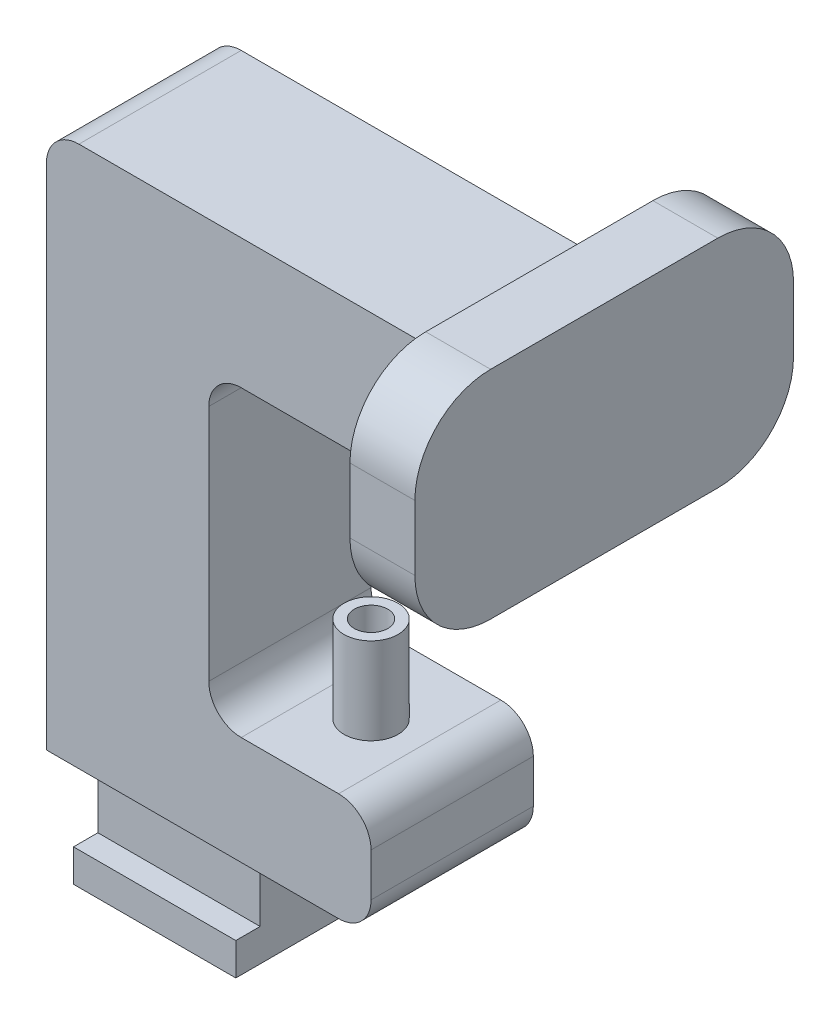
from build123d import *

# Parameters (mm, degrees)
BOSS_EXTRUDE1_DEPTH = 15
BOSS_EXTRUDE2_DEPTH = 10
SKETCH3_R           = 1.55
CUT_EXTRUDE1_DEPTH  = 50.497474683
BOSS_EXTRUDE3_START = 8
SKETCH4_R           = 2.5
SKETCH4_R_2         = 1.55
BOSS_EXTRUDE3_DEPTH = 8
SKETCH5_W           = 15
SKETCH5_H           = 12
BOSS_EXTRUDE4_DEPTH = 23.05
BOSS_EXTRUDE5_DEPTH = 5
SKETCH9_W           = 35
SKETCH9_H           = 20
BOSS_EXTRUDE6_DEPTH = 6
FILLET1_R           = 7
FILLET4_R           = 3
FILLET6_R           = 1


with BuildPart() as part:
    # Sketch1 → Boss-Extrude1 (new body)
    with BuildSketch(Plane.XY):
        Polygon((0, 0), (0, -50), (25, -50), (25, -40), (10, -40), (10, 0), align=None)
    extrude(amount=BOSS_EXTRUDE1_DEPTH)

    # Sketch2 → Boss-Extrude2 (add)
    with BuildSketch(Plane.ZY):
        Polygon((10.25, -59), (10.25, -50), (4.75, -50), (4.75, -59), (2.5, -59), (2.5, -62), (6.725601587, -62), (8.274398413, -62), (12.5, -62), (12.5, -59), align=None)
    extrude(amount=-BOSS_EXTRUDE2_DEPTH)

    # Sketch3 → Cut-Extrude1 (cut, through all)
    with BuildSketch(Plane(origin=(0, -40, 0), x_dir=(1, 0, 0), z_dir=(0, 1, 0))):
        with Locations(Location((17.5, -7.5, 0), (0, 0, 270))):
            Circle(SKETCH3_R)
    extrude(amount=-CUT_EXTRUDE1_DEPTH, mode=Mode.SUBTRACT)

    # Sketch4 → Boss-Extrude3 (add)
    with BuildSketch(Plane(origin=(0, -40, 0), x_dir=(1, 0, 0), z_dir=(0, 1, 0)).offset(BOSS_EXTRUDE3_START)):
        with Locations(Location((17.5, -7.5, 0), (0, 0, 90))):
            Circle(SKETCH4_R)
        with Locations(Location((17.5, -7.5, 0), (0, 0, 270))):
            Circle(SKETCH4_R_2, mode=Mode.SUBTRACT)
    extrude(amount=-BOSS_EXTRUDE3_DEPTH)

    # Sketch5 → Boss-Extrude4 (add)
    with BuildSketch(Plane(origin=(10, 0, 0), x_dir=(0, 0, -1), z_dir=(1, 0, 0))):
        with Locations((-7.5, -6)):
            Rectangle(SKETCH5_W, SKETCH5_H)
    extrude(amount=BOSS_EXTRUDE4_DEPTH)

    # Sketch7 → Boss-Extrude5 (add)
    with BuildSketch(Plane.ZY):
        Polygon((0, 0), (0, -50), (4.75, -50), (4.75, -59), (2.5, -59), (2.5, -62), (12.5, -62), (12.5, -59), (10.25, -59), (10.25, -50), (15, -50), (15, 0), align=None)
    extrude(amount=BOSS_EXTRUDE5_DEPTH)

    # Sketch9 → Boss-Extrude6 (add)
    with BuildSketch(Plane(origin=(33.05, 0, 0), x_dir=(0, 0, -1), z_dir=(1, 0, 0))):
        with Locations((-7.5, -6)):
            Rectangle(SKETCH9_W, SKETCH9_H)
    extrude(amount=BOSS_EXTRUDE6_DEPTH)

    # Fillet1
    fillet1_edges = [part.edges().sort_by_distance(p)[0] for p in [
        (36.05, -16, -10),
        (36.05, 4, -10),
        (36.05, 4, 25),
        (36.05, -16, 25),
    ]]
    fillet(fillet1_edges, radius=FILLET1_R)

    # Fillet4
    fillet4_edges = [part.edges().sort_by_distance(p)[0] for p in [
        (10, -40, 7.5),
        (25, -40, 7.5),
        (25, -50, 7.5),
        (10, -12, 7.5),
        (-5, 0, 7.5),
    ]]
    fillet(fillet4_edges, radius=FILLET4_R)

    # Fillet6
    fillet6_edges = [part.edges().sort_by_distance(p)[0] for p in [
        (33.05, -6, 15),
        (33.05, -12, 7.5),
        (33.05, -6, 0),
        (33.05, 0, 7.5),
    ]]
    fillet(fillet6_edges, radius=FILLET6_R)


solid = part.part
